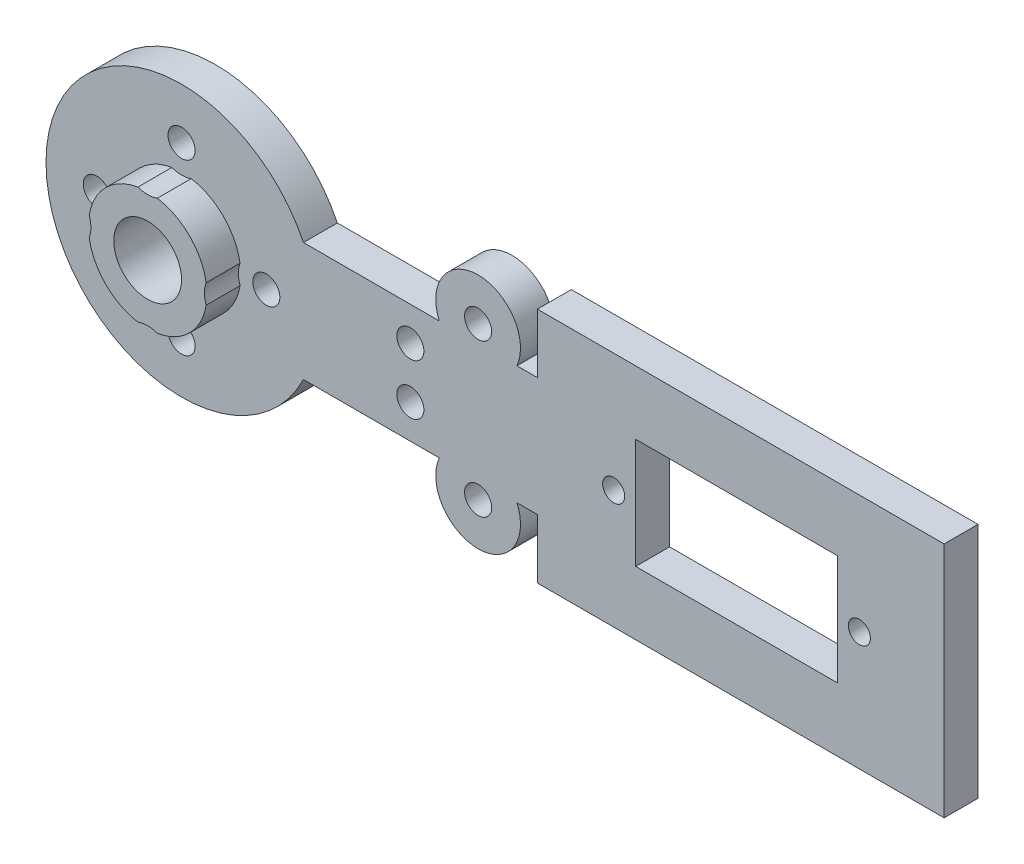
from build123d import *

# Parameters (mm, degrees)
MAIN_WEB_PROFILE_W                        = 60
MAIN_WEB_PROFILE_H                        = 14
MAIN_WEB_DEPTH                            = 4
SHOULDER_HORN_FLANGE_PROFILE_R            = 16
SHOULDER_HORN_FLANGE_DEPTH                = 4
ELBOW_SERVO_MOUNT_PROFILE_W               = 48
ELBOW_SERVO_MOUNT_PROFILE_H               = 28
ELBOW_SERVO_MOUNT_DEPTH                   = 4
SG90_BODY_CLEARANCE_START                 = -5
SG90_BODY_CLEARANCE_PROFILE_W             = 23.8
SG90_BODY_CLEARANCE_PROFILE_H             = 13
SG90_BODY_CLEARANCE_DEPTH                 = 97.49863387
ELBOW_TAB_FASTENERS_START                 = -50
ELBOW_TAB_FASTENERS_PROFILE_R             = 1.3
ELBOW_TAB_FASTENERS_DEPTH                 = 142.49863387
SHOULDER_CENTER_SCREW_ACCESS_START        = -50
SHOULDER_CENTER_SCREW_ACCESS_PROFILE_R    = 4
SHOULDER_CENTER_SCREW_ACCESS_DEPTH        = 142.49863387
SHOULDER_HORN_BOLT_PATTERN_START          = -50
SHOULDER_HORN_BOLT_PATTERN_PROFILE_R      = 1.6
SHOULDER_HORN_BOLT_PATTERN_DEPTH          = 142.49863387
CABLE_TIE_HOLES_START                     = -50
CABLE_TIE_HOLES_PROFILE_R                 = 1.6
CABLE_TIE_HOLES_DEPTH                     = 142.49863387
PASSIVE_LOWER_MOUNT_BOSS_PROFILE_R        = 5
PASSIVE_LOWER_MOUNT_BOSS_DEPTH            = 4
PASSIVE_UPPER_MOUNT_BOSS_PROFILE_R        = 5
PASSIVE_UPPER_MOUNT_BOSS_DEPTH            = 4
PASSIVE_CHEEK_STANDOFFS_START             = -50
PASSIVE_CHEEK_STANDOFFS_PROFILE_R         = 1.6
PASSIVE_CHEEK_STANDOFFS_DEPTH             = 142.49863387
SHOULDER_DOWEL_SUPPORT_HUB_START          = 4
SHOULDER_DOWEL_SUPPORT_HUB_PROFILE_R      = 7
SHOULDER_DOWEL_SUPPORT_HUB_PROFILE_R_2    = 4
SHOULDER_DOWEL_SUPPORT_HUB_DEPTH          = 4
SHOULDER_HORN_WASHER_HUB_RELIEF_START     = 4
SHOULDER_HORN_WASHER_HUB_RELIEF_PROFILE_R = 3.3
SHOULDER_HORN_WASHER_HUB_RELIEF_DEPTH     = 4


with BuildPart() as part:
    # Main_web_profile → Main_web (new body)
    with BuildSketch(Plane.XY):
        with Locations((30, 0)):
            Rectangle(MAIN_WEB_PROFILE_W, MAIN_WEB_PROFILE_H)
    extrude(amount=MAIN_WEB_DEPTH)

    # Shoulder_horn_flange_profile → Shoulder_horn_flange (add)
    with BuildSketch(Plane.XY):
        Circle(SHOULDER_HORN_FLANGE_PROFILE_R)
    extrude(amount=SHOULDER_HORN_FLANGE_DEPTH)

    # Elbow_servo_mount_profile → Elbow_servo_mount (add)
    with BuildSketch(Plane.XY):
        with Locations((66, 0)):
            Rectangle(ELBOW_SERVO_MOUNT_PROFILE_W, ELBOW_SERVO_MOUNT_PROFILE_H)
    extrude(amount=ELBOW_SERVO_MOUNT_DEPTH)

    # SG90_body_clearance_profile → SG90_body_clearance (cut, through all)
    with BuildSketch(Plane.XY.offset(SG90_BODY_CLEARANCE_START)):
        with Locations((65.5, 0)):
            Rectangle(SG90_BODY_CLEARANCE_PROFILE_W, SG90_BODY_CLEARANCE_PROFILE_H)
    extrude(amount=SG90_BODY_CLEARANCE_DEPTH, mode=Mode.SUBTRACT)

    # Elbow_tab_fasteners_profile → Elbow_tab_fasteners (cut, through all)
    with BuildSketch(Plane.XY.offset(ELBOW_TAB_FASTENERS_START)):
        with Locations(Location((51, 0, 0), (0, 0, 180))):
            Circle(ELBOW_TAB_FASTENERS_PROFILE_R)
        with Locations(Location((80, 0, 0), (0, 0, 180))):
            Circle(ELBOW_TAB_FASTENERS_PROFILE_R)
    extrude(amount=ELBOW_TAB_FASTENERS_DEPTH, mode=Mode.SUBTRACT)

    # Shoulder_center_screw_access_profile → Shoulder_center_screw_access (cut, through all)
    with BuildSketch(Plane.XY.offset(SHOULDER_CENTER_SCREW_ACCESS_START)):
        with Locations(Location((0, 0, 0), (0, 0, 180))):
            Circle(SHOULDER_CENTER_SCREW_ACCESS_PROFILE_R)
    extrude(amount=SHOULDER_CENTER_SCREW_ACCESS_DEPTH, mode=Mode.SUBTRACT)

    # Shoulder_horn_bolt_pattern_profile → Shoulder_horn_bolt_pattern (cut, through all)
    with BuildSketch(Plane.XY.offset(SHOULDER_HORN_BOLT_PATTERN_START)):
        with Locations(Location((0, 10, 0), (0, 0, 180))):
            Circle(SHOULDER_HORN_BOLT_PATTERN_PROFILE_R)
        with Locations(Location((0, -10, 0), (0, 0, 180))):
            Circle(SHOULDER_HORN_BOLT_PATTERN_PROFILE_R)
        with Locations(Location((10, 0, 0), (0, 0, 180))):
            Circle(SHOULDER_HORN_BOLT_PATTERN_PROFILE_R)
        with Locations(Location((-10, 0, 0), (0, 0, 180))):
            Circle(SHOULDER_HORN_BOLT_PATTERN_PROFILE_R)
    extrude(amount=SHOULDER_HORN_BOLT_PATTERN_DEPTH, mode=Mode.SUBTRACT)

    # Cable_tie_holes_profile → Cable_tie_holes (cut, through all)
    with BuildSketch(Plane.XY.offset(CABLE_TIE_HOLES_START)):
        with Locations(Location((27, -3, 0), (0, 0, 180))):
            Circle(CABLE_TIE_HOLES_PROFILE_R)
        with Locations(Location((27, 3, 0), (0, 0, 180))):
            Circle(CABLE_TIE_HOLES_PROFILE_R)
    extrude(amount=CABLE_TIE_HOLES_DEPTH, mode=Mode.SUBTRACT)

    # Passive_lower_mount_boss_profile → Passive_lower_mount_boss (add)
    with BuildSketch(Plane.XY):
        with Locations((35, -9)):
            Circle(PASSIVE_LOWER_MOUNT_BOSS_PROFILE_R)
    extrude(amount=PASSIVE_LOWER_MOUNT_BOSS_DEPTH)

    # Passive_upper_mount_boss_profile → Passive_upper_mount_boss (add)
    with BuildSketch(Plane.XY):
        with Locations((35, 9)):
            Circle(PASSIVE_UPPER_MOUNT_BOSS_PROFILE_R)
    extrude(amount=PASSIVE_UPPER_MOUNT_BOSS_DEPTH)

    # Passive_cheek_standoffs_profile → Passive_cheek_standoffs (cut, through all)
    with BuildSketch(Plane.XY.offset(PASSIVE_CHEEK_STANDOFFS_START)):
        with Locations(Location((35, -9, 0), (0, 0, 180))):
            Circle(PASSIVE_CHEEK_STANDOFFS_PROFILE_R)
        with Locations(Location((35, 9, 0), (0, 0, 180))):
            Circle(PASSIVE_CHEEK_STANDOFFS_PROFILE_R)
    extrude(amount=PASSIVE_CHEEK_STANDOFFS_DEPTH, mode=Mode.SUBTRACT)

    # Shoulder_dowel_support_hub_profile → Shoulder_dowel_support_hub (add)
    with BuildSketch(Plane.XY.offset(SHOULDER_DOWEL_SUPPORT_HUB_START)):
        Circle(SHOULDER_DOWEL_SUPPORT_HUB_PROFILE_R)
        with Locations(Location((0, 0, 0), (0, 0, 180))):
            Circle(SHOULDER_DOWEL_SUPPORT_HUB_PROFILE_R_2, mode=Mode.SUBTRACT)
    extrude(amount=SHOULDER_DOWEL_SUPPORT_HUB_DEPTH)

    # Shoulder_horn_washer_hub_relief_profile → Shoulder_horn_washer_hub_relief (cut)
    with BuildSketch(Plane.XY.offset(SHOULDER_HORN_WASHER_HUB_RELIEF_START)):
        with Locations((10, 0)):
            Circle(SHOULDER_HORN_WASHER_HUB_RELIEF_PROFILE_R)
        with Locations((-10, 0)):
            Circle(SHOULDER_HORN_WASHER_HUB_RELIEF_PROFILE_R)
        with Locations((0, 10)):
            Circle(SHOULDER_HORN_WASHER_HUB_RELIEF_PROFILE_R)
        with Locations((0, -10)):
            Circle(SHOULDER_HORN_WASHER_HUB_RELIEF_PROFILE_R)
    extrude(amount=SHOULDER_HORN_WASHER_HUB_RELIEF_DEPTH, mode=Mode.SUBTRACT)


solid = part.part
